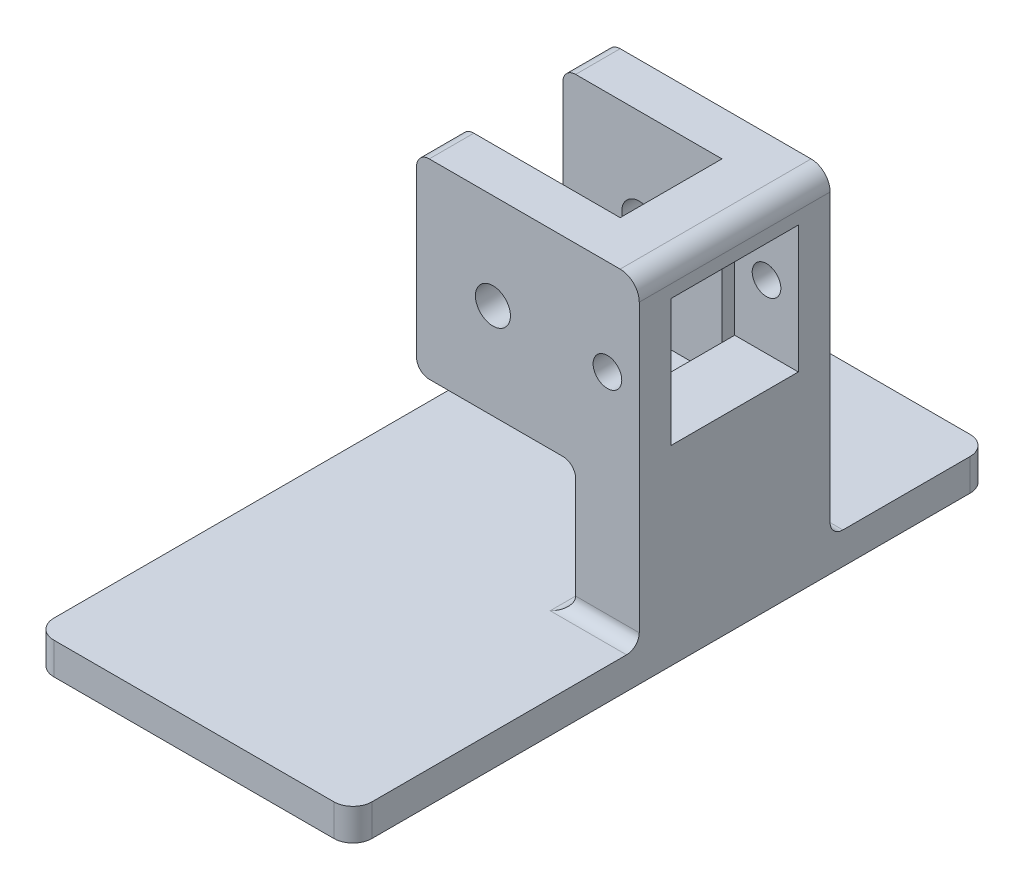
from build123d import *

# Parameters (mm, degrees)
SKETCH4_W            = 40
SKETCH4_H            = 80
BOSS_EXTRUDE4_DEPTH  = 5
SKETCH5_W            = 10
SKETCH5_H            = 5
BOSS_EXTRUDE6_DEPTH  = 50
SKETCH7_W            = 10
SKETCH7_H            = 25
SKETCH7_H_2          = 5
BOSS_EXTRUDE7_DEPTH  = 20
SKETCH9_W            = 80
SKETCH9_H            = 5
BOSS_EXTRUDE9_DEPTH  = 10
SKETCH10_W           = 50
SKETCH10_H           = 5
BOSS_EXTRUDE10_DEPTH = 20
SKETCH11_R           = 2.25
CUT_EXTRUDE1_DEPTH   = 25
SKETCH12_R           = 4
SKETCH12_R_2         = 2.25
CUT_EXTRUDE2_DEPTH   = 2
SKETCH15_W           = 7
SKETCH15_H           = 30
BOSS_EXTRUDE11_DEPTH = 20
CUT_EXTRUDE4_REACH   = 89.464
SKETCH16_R           = 2.75
FILLET3_R            = 3
SKETCH19_W           = 7
SKETCH19_H           = 30
BOSS_EXTRUDE12_DEPTH = 5
FILLET4_R            = 2
BOSS_EXTRUDE13_START = 2
SKETCH20_R           = 4
SKETCH20_R_2         = 2.25
BOSS_EXTRUDE13_DEPTH = 2


with BuildPart() as part:
    # Sketch4 → Boss-Extrude4 (new body)
    with BuildSketch(Plane(origin=(0, 0, 0), x_dir=(1, 0, 0), z_dir=(0, 1, 0))):
        with Locations((20, 40)):
            Rectangle(SKETCH4_W, SKETCH4_H)
    extrude(amount=BOSS_EXTRUDE4_DEPTH)

    # Sketch5 → Boss-Extrude6 (add)
    with BuildSketch(Plane(origin=(0, 5, 0), x_dir=(1, 0, 0), z_dir=(0, 1, 0))):
        with Locations((35, 52.5)):
            Rectangle(SKETCH5_W, SKETCH5_H)
        with Locations((35, 27.5)):
            Rectangle(SKETCH5_W, SKETCH5_H)
    extrude(amount=BOSS_EXTRUDE6_DEPTH)

    # Sketch7 → Boss-Extrude7 (add)
    with BuildSketch(Plane.XY.offset(-50)):
        with Locations((35, 17.5)):
            Rectangle(SKETCH7_W, SKETCH7_H)
        with Locations((35, 52.5)):
            Rectangle(SKETCH7_W, SKETCH7_H_2)
    extrude(amount=BOSS_EXTRUDE7_DEPTH)

    # Sketch9 → Boss-Extrude9 (add)
    with BuildSketch(Plane.ZY):
        with Locations((-40, 2.5)):
            Rectangle(SKETCH9_W, SKETCH9_H)
    extrude(amount=BOSS_EXTRUDE9_DEPTH)

    # Sketch10 → Boss-Extrude10 (add)
    with BuildSketch(Plane.XY):
        with Locations((15, 2.5)):
            Rectangle(SKETCH10_W, SKETCH10_H)
    extrude(amount=BOSS_EXTRUDE10_DEPTH)

    # Sketch11 → Cut-Extrude1 (cut, symmetric)
    with BuildSketch(Plane.XY.offset(-50)):
        with Locations((35, 40)):
            Circle(SKETCH11_R)
    extrude(amount=CUT_EXTRUDE1_DEPTH, both=True, mode=Mode.SUBTRACT)

    # Sketch12 → Cut-Extrude2 (cut)
    with BuildSketch(Plane.XY.offset(-25)):
        with Locations((35, 40)):
            Circle(SKETCH12_R)
        with Locations((35, 40)):
            Circle(SKETCH12_R_2, mode=Mode.SUBTRACT)
    extrude(amount=-CUT_EXTRUDE2_DEPTH, mode=Mode.SUBTRACT)

    # Sketch15 → Boss-Extrude11 (add)
    with BuildSketch(Plane.ZY.offset(-30)):
        with Locations((-51.5, 40)):
            Rectangle(SKETCH15_W, SKETCH15_H)
        with Locations((-28.5, 40)):
            Rectangle(SKETCH15_W, SKETCH15_H)
    extrude(amount=BOSS_EXTRUDE11_DEPTH)

    # Cut-Extrude4: up to this face of the body (flat: up to its plane)
    cut_extrude4_end = Plane(part.part.faces().sort_by_distance((26.698149798, 35.387860999, -55))[0])
    # Sketch16 → Cut-Extrude4 (cut, up to the picked face)
    with BuildSketch(Plane.XY.offset(-25), mode=Mode.PRIVATE) as cut_extrude4_sk1:
        with Locations((17, 40)):
            Circle(SKETCH16_R)
    cut_extrude4_tool1 = split(extrude(cut_extrude4_sk1.sketch, amount=-CUT_EXTRUDE4_REACH, mode=Mode.PRIVATE), bisect_by=cut_extrude4_end, keep=Keep.BOTH, mode=Mode.PRIVATE)
    add(cut_extrude4_tool1.solids().sort_by(Axis((17, 40, -25), (0, 0, -1)))[0], mode=Mode.SUBTRACT)

    # Fillet3
    fillet3_edges = [part.edges().sort_by_distance(p)[0] for p in [
        (40, 55, -40),
        (-10, 2.5, -80),
        (40, 2.5, -80),
        (-10, 2.5, 20),
        (40, 2.5, 20),
    ]]
    fillet(fillet3_edges, radius=FILLET3_R)

    # Sketch19 → Boss-Extrude12 (add)
    with BuildSketch(Plane.ZY.offset(-10)):
        with Locations((-51.5, 40)):
            Rectangle(SKETCH19_W, SKETCH19_H)
        with Locations((-28.5, 40)):
            Rectangle(SKETCH19_W, SKETCH19_H)
    extrude(amount=BOSS_EXTRUDE12_DEPTH)

    # Fillet4
    fillet4_edges = [part.edges().sort_by_distance(p)[0] for p in [
        (30, 25, -51.5),
        (30, 25, -28.5),
        (35, 5, -55),
        (30, 5, -40),
        (5, 55, -51.5),
        (5, 25, -51.5),
        (5, 25, -28.5),
        (5, 55, -28.5),
        (35, 5, -25),
    ]]
    fillet(fillet4_edges, radius=FILLET4_R)

    # Sketch20 → Boss-Extrude13 (add)
    with BuildSketch(Plane.XY.offset(-27).offset(BOSS_EXTRUDE13_START)):
        with Locations((35, 40)):
            Circle(SKETCH20_R)
        with Locations((35, 40)):
            Circle(SKETCH20_R_2, mode=Mode.SUBTRACT)
    extrude(amount=-BOSS_EXTRUDE13_DEPTH)


solid = part.part
